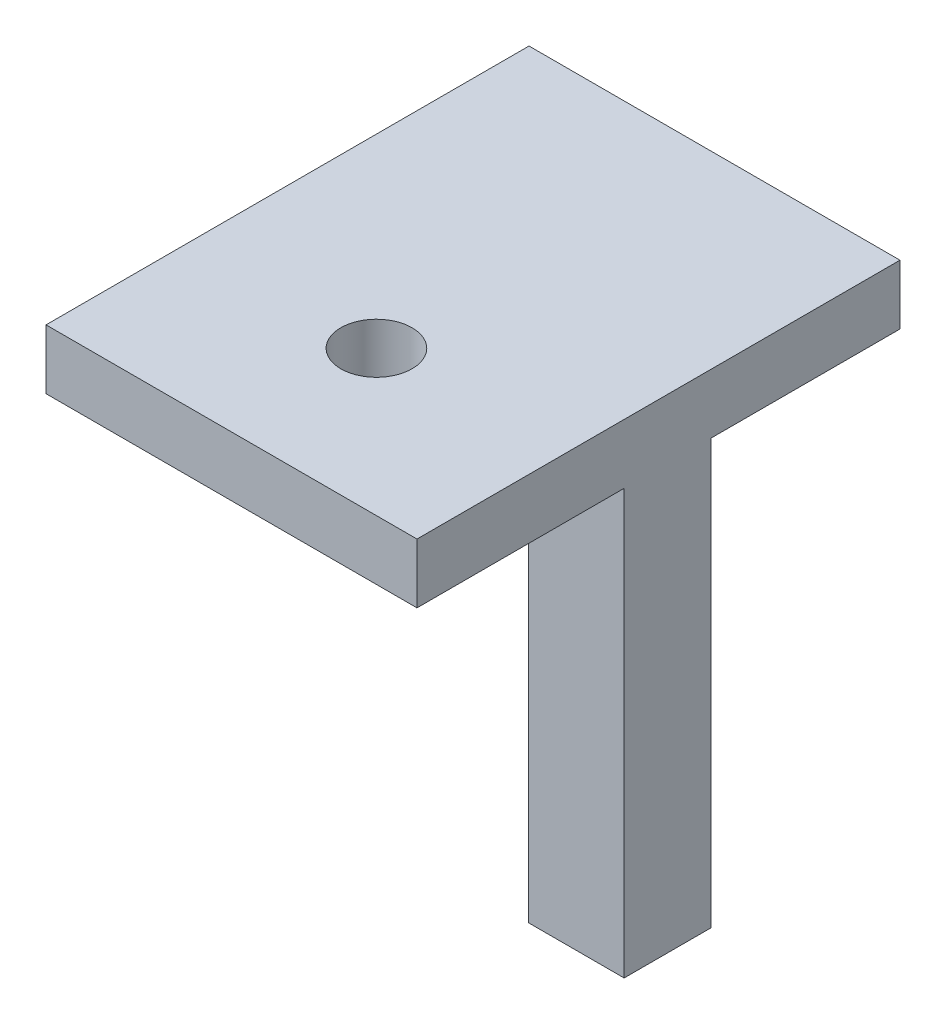
from build123d import *

# Parameters (mm, degrees)
SKETCH1_W           = 62.2
SKETCH1_H           = 80.98413
BOSS_EXTRUDE1_DEPTH = 10
SKETCH2_R           = 5.969
CUT_EXTRUDE1_DEPTH  = 10
SKETCH3_W           = 16
SKETCH3_H           = 14.55264
BOSS_EXTRUDE2_DEPTH = 71.11


with BuildPart() as part:
    # Sketch1 → Boss-Extrude1 (new body)
    with BuildSketch(Plane(origin=(0, 0, 0), x_dir=(1, 0, 0), z_dir=(0, 1, 0))):
        Rectangle(SKETCH1_W, SKETCH1_H)
    extrude(amount=BOSS_EXTRUDE1_DEPTH)

    # Sketch2 → Cut-Extrude1 (cut)
    with BuildSketch(Plane(origin=(0, 10, 0), x_dir=(1, 0, 0), z_dir=(0, 1, 0))):
        with Locations(Location((0, -16.192065, 0), (0, 0, 270))):
            Circle(SKETCH2_R)
    extrude(amount=-CUT_EXTRUDE1_DEPTH, mode=Mode.SUBTRACT)

    # Sketch3 → Boss-Extrude2 (add)
    with BuildSketch(Plane.XZ):
        with Locations((23.1, -1.515745)):
            Rectangle(SKETCH3_W, SKETCH3_H)
    extrude(amount=BOSS_EXTRUDE2_DEPTH)


solid = part.part
